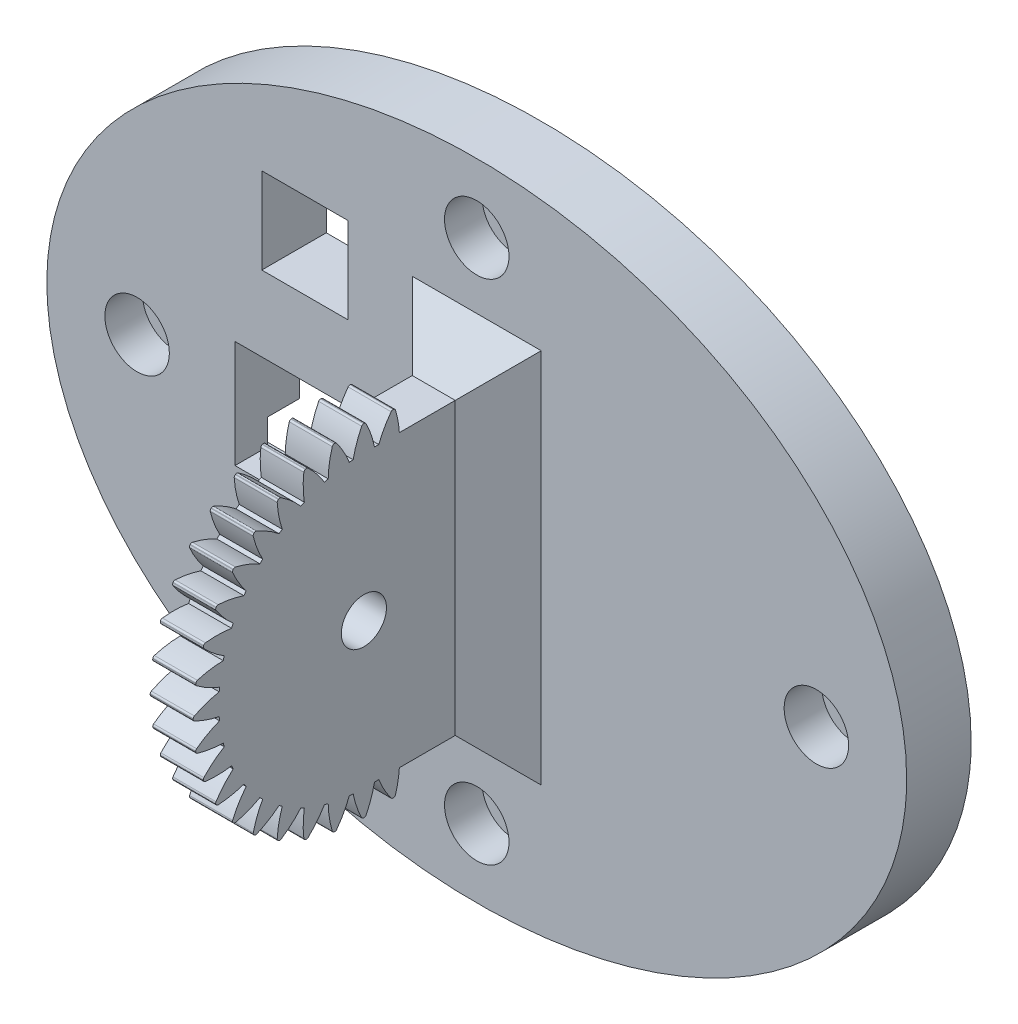
from build123d import *

# Parameters (mm, degrees)
SKETCH2_RX          = 50.8
SKETCH2_RY          = 38.1
BOSS_EXTRUDE1_DEPTH = 7.62
SKETCH6_R           = 2.2225
CUT_EXTRUDE1_DEPTH  = 64.955565825
SKETCH7_R           = 3.81
CUT_EXTRUDE2_DEPTH  = 4.445
SKETCH8_R           = 2.2225
CUT_EXTRUDE3_DEPTH  = 64.955565825
SKETCH9_R           = 3.81
CUT_EXTRUDE4_DEPTH  = 4.445
SKETCH10_W          = 5.08
SKETCH10_H          = 34.29
BOSS_EXTRUDE2_DEPTH = 15.875
CHAMFER1_SIZE       = 5.08
SKETCH11_R          = 2.667
CUT_EXTRUDE5_DEPTH  = 70.633186233
SKETCH14_R          = 17.145
SKETCH14_R_2        = 2.667
BOSS_EXTRUDE3_DEPTH = 5.08
BOSS_EXTRUDE4_DEPTH = 5.08
CIRPATTERN1_COUNT   = 36
SKETCH16_W          = 13.335
SKETCH16_H          = 12.7
CUT_EXTRUDE7_DEPTH  = 7.62
SKETCH17_W          = 58.42
SKETCH17_H          = 6.35
CUT_EXTRUDE8_DEPTH  = 3.81
SKETCH19_W          = 10.795
SKETCH19_H          = 12.7
CUT_EXTRUDE9_DEPTH  = 5.842
SKETCH21_W          = 10.16
SKETCH21_H          = 10.16
CUT_EXTRUDE11_DEPTH = 10.16
SKETCH22_W          = 6.35
SKETCH22_H          = 2.54
CUT_EXTRUDE12_DEPTH = 5.08


with BuildPart() as part:
    # Sketch2 → Boss-Extrude1 (new body)
    with BuildSketch(Plane.XY):
        with Locations((0, 0)):
            Ellipse(SKETCH2_RX, SKETCH2_RY)
    extrude(amount=BOSS_EXTRUDE1_DEPTH)

    # Sketch6 → Cut-Extrude1 (cut, through all)
    with BuildSketch(Plane.XY.offset(7.62)):
        with Locations((0, 29.972)):
            Circle(SKETCH6_R)
    cut_extrude1 = extrude(amount=-CUT_EXTRUDE1_DEPTH, mode=Mode.SUBTRACT)

    # Sketch7 → Cut-Extrude2 (cut)
    with BuildSketch(Plane.XY.offset(7.62)):
        with Locations((0, 29.972)):
            Circle(SKETCH7_R)
    cut_extrude2 = extrude(amount=-CUT_EXTRUDE2_DEPTH, mode=Mode.SUBTRACT)

    # Mirror1: Cut-Extrude1, Cut-Extrude2 across plane
    add(cut_extrude1.mirror(Plane.ZX), mode=Mode.SUBTRACT)
    add(cut_extrude2.mirror(Plane.ZX), mode=Mode.SUBTRACT)

    # Sketch8 → Cut-Extrude3 (cut, through all)
    with BuildSketch(Plane.XY.offset(7.62)):
        with Locations((-40.132, 0)):
            Circle(SKETCH8_R)
    cut_extrude3 = extrude(amount=-CUT_EXTRUDE3_DEPTH, mode=Mode.SUBTRACT)

    # Sketch9 → Cut-Extrude4 (cut)
    with BuildSketch(Plane.XY.offset(7.62)):
        with Locations((-40.132, 0)):
            Circle(SKETCH9_R)
    cut_extrude4 = extrude(amount=-CUT_EXTRUDE4_DEPTH, mode=Mode.SUBTRACT)

    # Mirror2: Cut-Extrude3, Cut-Extrude4 across plane
    add(cut_extrude3.mirror(Plane(origin=(0, 0, 0), x_dir=(0, 0, 1), z_dir=(1, 0, 0))), mode=Mode.SUBTRACT)
    add(cut_extrude4.mirror(Plane(origin=(0, 0, 0), x_dir=(0, 0, 1), z_dir=(1, 0, 0))), mode=Mode.SUBTRACT)

    # Sketch10 → Boss-Extrude2 (add)
    with BuildSketch(Plane.XY.offset(7.62)):
        Rectangle(SKETCH10_W, SKETCH10_H)
    extrude(amount=BOSS_EXTRUDE2_DEPTH)

    # Chamfer1
    chamfer1_edges = [part.edges().sort_by_distance(p)[0] for p in [
        (-2.54, 0, 7.62),
        (0, -17.145, 7.62),
        (0, 17.145, 7.62),
        (2.54, 0, 7.62),
    ]]
    chamfer(chamfer1_edges, length=CHAMFER1_SIZE)

    # Sketch11 → Cut-Extrude5 (cut, through all)
    with BuildSketch(Plane.ZY.offset(2.54)):
        with Locations((23.495, 0)):
            Circle(SKETCH11_R)
    extrude(amount=-CUT_EXTRUDE5_DEPTH, mode=Mode.SUBTRACT)

    # Sketch14 → Boss-Extrude3 (add)
    with BuildSketch(Plane.ZY.offset(2.54)):
        with Locations((23.495, 0)):
            Circle(SKETCH14_R)
        with Locations(Location((23.495, 0, 0), (0, 0, 270))):
            Circle(SKETCH14_R_2, mode=Mode.SUBTRACT)
    extrude(amount=-BOSS_EXTRUDE3_DEPTH)

    # Sketch13 → Boss-Extrude4 (add)
    with BuildSketch(Plane.ZY.offset(2.54)):
        with BuildLine():
            Line((43.6626, 0.035091978), (43.6626, -0.035091978))
            ThreePointArc((43.6626, -0.035091978), (43.624803487, -0.168403839), (43.522662582, -0.262040711))
            ThreePointArc((43.522662582, -0.262040711), (42.079626216, -0.867407849), (40.567428186, -1.27))
            ThreePointArc((40.567428186, -1.27), (40.6146, 0), (40.567428186, 1.27))
            ThreePointArc((40.567428186, 1.27), (42.079626216, 0.867407849), (43.522662582, 0.262040711))
            ThreePointArc((43.522662582, 0.262040711), (43.624803487, 0.168403839), (43.6626, 0.035091978))
        make_face()
    boss_extrude4 = extrude(amount=-BOSS_EXTRUDE4_DEPTH)

    # CirPattern1: Boss-Extrude4 ×36 about axis
    cirpattern1_axis = Axis((0, 0, 23.495), (1, 0, 0))
    for i in range(1, CIRPATTERN1_COUNT):
        add(boss_extrude4.rotate(cirpattern1_axis, i * 360 / CIRPATTERN1_COUNT))

    # Sketch16 → Cut-Extrude7 (cut)
    with BuildSketch(Plane.XY.offset(7.62)):
        with Locations((-21.8948, -1.27)):
            Rectangle(SKETCH16_W, SKETCH16_H)
    extrude(amount=-CUT_EXTRUDE7_DEPTH, mode=Mode.SUBTRACT)

    # Sketch17 → Cut-Extrude8 (cut)
    with BuildSketch(Plane(origin=(0, 0, 0), x_dir=(-1, 0, 0), z_dir=(0, 0, -1))):
        with Locations((10.7823, -7.747)):
            Rectangle(SKETCH17_W, SKETCH17_H)
    extrude(amount=-CUT_EXTRUDE8_DEPTH, mode=Mode.SUBTRACT)

    # Sketch19 → Cut-Extrude9 (cut)
    with BuildSketch(Plane(origin=(0, 0, 0), x_dir=(-1, 0, 0), z_dir=(0, 0, -1))):
        with Locations((-7.8994, -1.27)):
            Rectangle(SKETCH19_W, SKETCH19_H)
    extrude(amount=-CUT_EXTRUDE9_DEPTH, mode=Mode.SUBTRACT)

    # Sketch21 → Cut-Extrude11 (cut)
    with BuildSketch(Plane.XY.offset(7.62)):
        with Locations((-20.32, 19.05)):
            Rectangle(SKETCH21_W, SKETCH21_H)
    extrude(amount=-CUT_EXTRUDE11_DEPTH, mode=Mode.SUBTRACT)

    # Sketch22 → Cut-Extrude12 (cut)
    with BuildSketch(Plane.ZY.offset(2.54)):
        with Locations((16.127552663, 18.415)):
            Rectangle(SKETCH22_W, SKETCH22_H)
        with Locations((16.127552663, -18.415)):
            Rectangle(SKETCH22_W, SKETCH22_H)
    extrude(amount=-CUT_EXTRUDE12_DEPTH, mode=Mode.SUBTRACT)


solid = part.part
